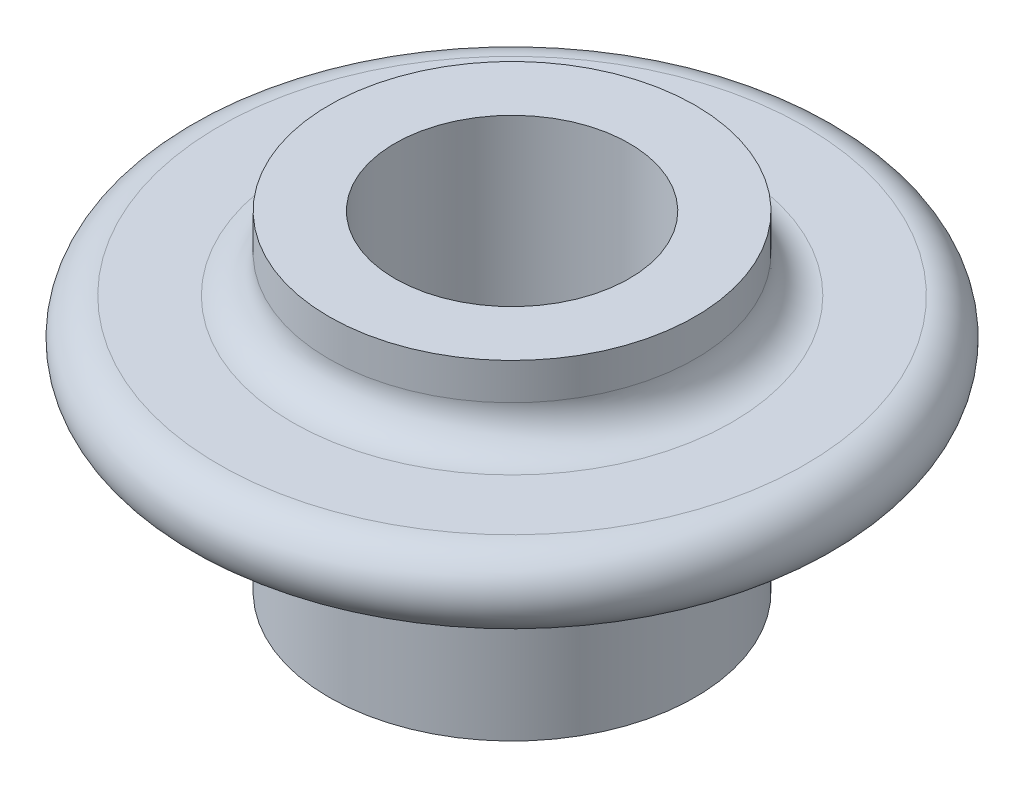
from build123d import *

# Parameters (mm, degrees)
M36_TAPPED_HOLE1_D = 32
FILLET1_R          = 5
FILLET2_R          = 1


with BuildPart() as part:
    # Sketch1 → Revolve1 (revolve)
    with BuildSketch(Plane.XY, mode=Mode.PRIVATE) as revolve1_sk:
        with BuildLine():
            Line((0, 0), (0, 45))
            Line((0, 45), (25, 45))
            Line((25, 45), (25, 35))
            Line((25, 35), (40, 35))
            ThreePointArc((40, 35), (45, 30), (40, 25))
            Line((40, 25), (25, 25))
            Line((25, 25), (25, 0))
            Line((25, 0), (0, 0))
        make_face()
    revolve(revolve1_sk.sketch.rotate(Axis((0, 0, 0), (0, 1, 0)), 90), axis=Axis((0, 0, 0), (0, 1, 0)))

    # M36 Tapped Hole1 (through all)
    with Locations(Plane.ZX.offset(45)):
        with Locations((0, 0)):
            Hole(M36_TAPPED_HOLE1_D / 2)

    # Fillet1
    fillet1_edges = [part.edges().sort_by_distance(p)[0] for p in [
        (0, 35, 25),
    ]]
    fillet(fillet1_edges, radius=FILLET1_R)

    # Fillet2
    fillet2_edges = [part.edges().sort_by_distance(p)[0] for p in [
        (0, 25, 25),
    ]]
    fillet(fillet2_edges, radius=FILLET2_R)


solid = part.part
